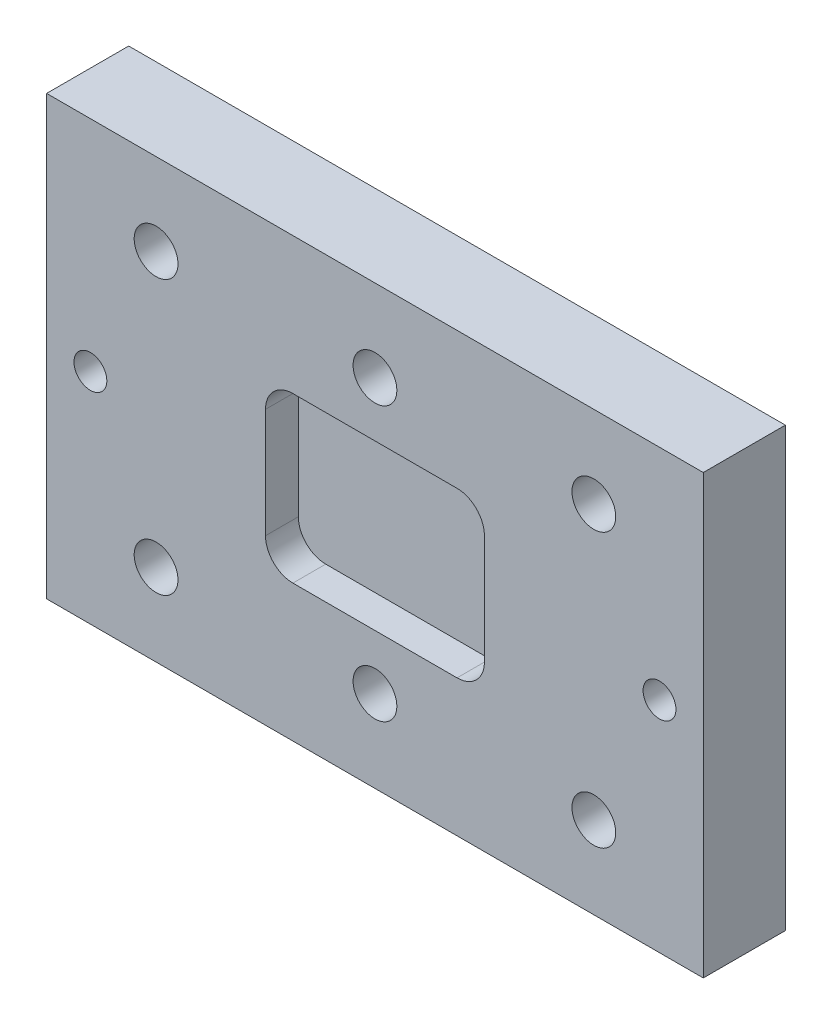
from build123d import *

# Parameters (mm, degrees)
SKETCH_1_W          = 120
SKETCH_1_H          = 80
EXTRUDE_1_DEPTH     = 15
CUT_EXTRUDE_1_DEPTH = 6
SKETCH_3_R          = 4
CUT_EXTRUDE_2_DEPTH = 74.654599313
SKETCH_4_R          = 3
CUT_EXTRUDE_3_DEPTH = 10


with BuildPart() as part:
    # 草图1 → 凸台-拉伸1 (new body)
    with BuildSketch(Plane.XY):
        Rectangle(SKETCH_1_W, SKETCH_1_H)
    extrude(amount=EXTRUDE_1_DEPTH)

    # 草图2 → 切除-拉伸1 (cut)
    with BuildSketch(Plane.XY.offset(15)):
        with BuildLine():
            Line((-15, -15), (15, -15))
            ThreePointArc((15, -15), (18.535533906, -13.535533906), (20, -10))
            Line((20, -10), (20, 10))
            ThreePointArc((20, 10), (18.535533906, 13.535533906), (15, 15))
            Line((15, 15), (-15, 15))
            ThreePointArc((-15, 15), (-18.535533906, 13.535533906), (-20, 10))
            Line((-20, 10), (-20, -10))
            ThreePointArc((-20, -10), (-18.535533906, -13.535533906), (-15, -15))
        make_face()
    extrude(amount=-CUT_EXTRUDE_1_DEPTH, mode=Mode.SUBTRACT)

    # 草图3 → 切除-拉伸2 (cut, through all)
    with BuildSketch(Plane.XY.offset(15)):
        with Locations((0, 25)):
            Circle(SKETCH_3_R)
        with Locations((0, -25)):
            Circle(SKETCH_3_R)
        with Locations((40, 25)):
            Circle(SKETCH_3_R)
        with Locations((40, -25)):
            Circle(SKETCH_3_R)
        with Locations((-40, 25)):
            Circle(SKETCH_3_R)
        with Locations((-40, -25)):
            Circle(SKETCH_3_R)
    extrude(amount=-CUT_EXTRUDE_2_DEPTH, mode=Mode.SUBTRACT)

    # 草图4 → 切除-拉伸3 (cut)
    with BuildSketch(Plane.XY.offset(15)):
        with Locations((52, 0)):
            Circle(SKETCH_4_R)
        with Locations((-52, 0)):
            Circle(SKETCH_4_R)
    extrude(amount=-CUT_EXTRUDE_3_DEPTH, mode=Mode.SUBTRACT)


solid = part.part
